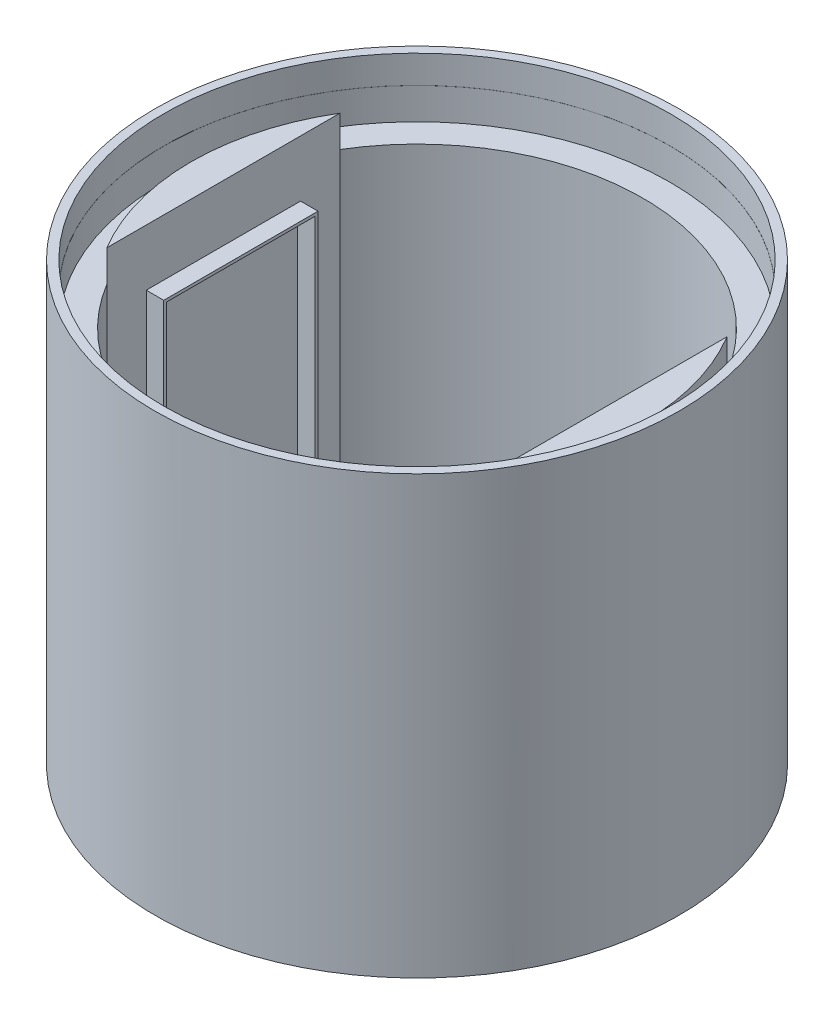
from build123d import *

# Parameters (mm, degrees)
SKETCH1_R               = 45
BOSS_EXTRUDE1_DEPTH     = 15
SKETCH2_R               = 43.5
CUT_EXTRUDE1_DEPTH      = 4.8
SKETCH3_R               = 43.487927738
SKETCH3_R_2             = 38.8
CUT_EXTRUDE2_DEPTH      = 5.4
BOSS_EXTRUDE2_START     = 60
SKETCH4_R               = 45
BOSS_EXTRUDE2_DEPTH     = 60
SKETCH6_R               = 8
CUT_EXTRUDE4_DEPTH      = 71
CUT_EXTRUDE6_DEPTH      = 66
SKETCH11_W              = 26.5
SKETCH11_H              = 38.6
SKETCH11_W_2            = 25.5
SKETCH11_H_2            = 37.6
BOSS_EXTRUDE3_DEPTH     = 3
SKETCH12_W              = 10
SKETCH12_H              = 14
CUT_EXTRUDE_THIN1_DEPTH = 10
SKETCH13_R              = 2
CUT_EXTRUDE7_DEPTH      = 10


with BuildPart() as part:
    # Sketch1 → Boss-Extrude1 (new body)
    with BuildSketch(Plane(origin=(0, 0, 0), x_dir=(1, 0, 0), z_dir=(0, 1, 0))):
        with Locations(Location((0, 0, 0), (0, 0, 270))):
            Circle(SKETCH1_R)
    extrude(amount=BOSS_EXTRUDE1_DEPTH)

    # Sketch2 → Cut-Extrude1 (cut)
    with BuildSketch(Plane(origin=(0, 15, 0), x_dir=(1, 0, 0), z_dir=(0, 1, 0))):
        with Locations(Location((0, 0, 0), (0, 0, 270))):
            Circle(SKETCH2_R)
    extrude(amount=-CUT_EXTRUDE1_DEPTH, mode=Mode.SUBTRACT)

    # Sketch3 → Cut-Extrude2 (cut)
    with BuildSketch(Plane(origin=(0, 10.2, 0), x_dir=(1, 0, 0), z_dir=(0, 1, 0))):
        with Locations(Location((0, 0, 0), (0, 0, 270))):
            Circle(SKETCH3_R)
        with Locations(Location((0, 0, 0), (0, 0, 270))):
            Circle(SKETCH3_R_2, mode=Mode.SUBTRACT)
    extrude(amount=-CUT_EXTRUDE2_DEPTH, mode=Mode.SUBTRACT)

    # Sketch4 → Boss-Extrude2 (add)
    with BuildSketch(Plane.XZ.offset(BOSS_EXTRUDE2_START)):
        with Locations(Location((0, 0, 0), (0, 0, 270))):
            Circle(SKETCH4_R)
    extrude(amount=-BOSS_EXTRUDE2_DEPTH)

    # Sketch6 → Cut-Extrude4 (cut)
    with BuildSketch(Plane.XZ.offset(60)):
        with Locations(Location((0, 0, 0), (0, 0, 270))):
            Circle(SKETCH6_R)
    extrude(amount=-CUT_EXTRUDE4_DEPTH, mode=Mode.SUBTRACT)

    # Sketch10 → Cut-Extrude6 (cut)
    with BuildSketch(Plane(origin=(0, 10.2, 0), x_dir=(1, 0, 0), z_dir=(0, 1, 0))):
        with BuildLine():
            Line((-33.248157844, 20), (-33.248157844, -20))
            ThreePointArc((-33.248157844, -20), (0, -38.8), (33.248157844, -20))
            Line((33.248157844, -20), (33.248157844, 20))
            ThreePointArc((33.248157844, 20), (0, 38.8), (-33.248157844, 20))
        make_face()
    extrude(amount=-CUT_EXTRUDE6_DEPTH, mode=Mode.SUBTRACT)

    # Sketch11 → Boss-Extrude3 (add)
    with BuildSketch(Plane(origin=(-33.248157844, 0, 0), x_dir=(0, 0, -1), z_dir=(1, 0, 0))):
        with Locations((0, -18.8)):
            Rectangle(SKETCH11_W, SKETCH11_H)
        with Locations((0, -18.8)):
            Rectangle(SKETCH11_W_2, SKETCH11_H_2, mode=Mode.SUBTRACT)
    boss_extrude3 = extrude(amount=BOSS_EXTRUDE3_DEPTH)

    # Mirror1: Boss-Extrude3 across plane
    add(boss_extrude3.mirror(Plane(origin=(0, 0, 0), x_dir=(0, 0, 1), z_dir=(1, 0, 0))))

    # Sketch12 → Cut-Extrude-Thin1 (cut)
    with BuildSketch(Plane(origin=(0, -55.8, 0), x_dir=(1, 0, 0), z_dir=(0, 1, 0))):
        with Locations((-24.509146191, 0)):
            Rectangle(SKETCH12_W, SKETCH12_H)
        with Locations((21.509146191, 0)):
            Rectangle(SKETCH12_W, SKETCH12_H)
    extrude(amount=-CUT_EXTRUDE_THIN1_DEPTH, mode=Mode.SUBTRACT)

    # Sketch13 → Cut-Extrude7 (cut)
    with BuildSketch(Plane.XZ.offset(60)):
        with Locations(Location((0, 35, 0), (0, 0, 270))):
            Circle(SKETCH13_R)
        with Locations(Location((0, -35, 0), (0, 0, 90))):
            Circle(SKETCH13_R)
    extrude(amount=-CUT_EXTRUDE7_DEPTH, mode=Mode.SUBTRACT)


solid = part.part
